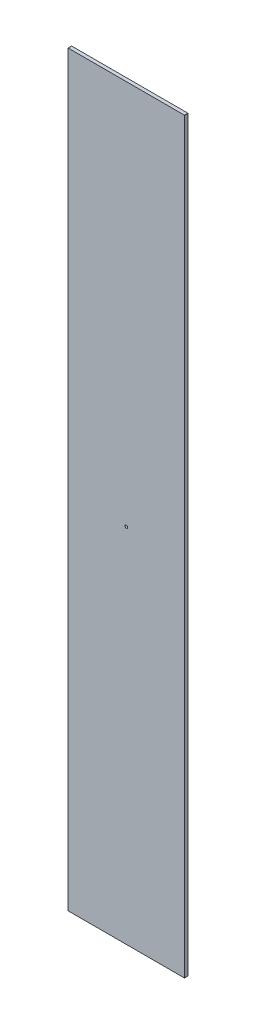
from build123d import *

# Parameters (mm, degrees)
SKETCH1_W               = 214.341591878
SKETCH1_H               = 1374.4956
BOSS_EXTRUDE1_DEPTH     = 6.35
FILLET1_R               = 0.254
CUT_EXTRUDE1_DEPTH      = 790.966681834
CUT_EXTRUDE1_DEPTH_BACK = 790.966681834
SKETCH2_R               = 2.54


with BuildPart() as part:
    # Sketch1 → Boss-Extrude1 (new body)
    with BuildSketch(Plane.XY):
        with Locations((0, -95.3897)):
            Rectangle(SKETCH1_W, SKETCH1_H)
    extrude(amount=BOSS_EXTRUDE1_DEPTH)

    # Fillet1
    fillet1_edges = [part.edges().sort_by_distance(p)[0] for p in [
        (-107.170795939, 591.8581, 3.175),
        (107.170795939, 591.8581, 3.175),
        (107.170795939, -782.6375, 3.175),
        (-107.170795939, -782.6375, 3.175),
    ]]
    fillet(fillet1_edges, radius=FILLET1_R)

    # Sketch2 → Cut-Extrude1 (cut, two sides: drawn at the far end of the back side and taken through both)
    with BuildSketch(Plane.XY.offset(6.35).offset(-CUT_EXTRUDE1_DEPTH_BACK)):
        with Locations((0, -117.0813)):
            Circle(SKETCH2_R)
    extrude(amount=CUT_EXTRUDE1_DEPTH + CUT_EXTRUDE1_DEPTH_BACK, mode=Mode.SUBTRACT)


solid = part.part
